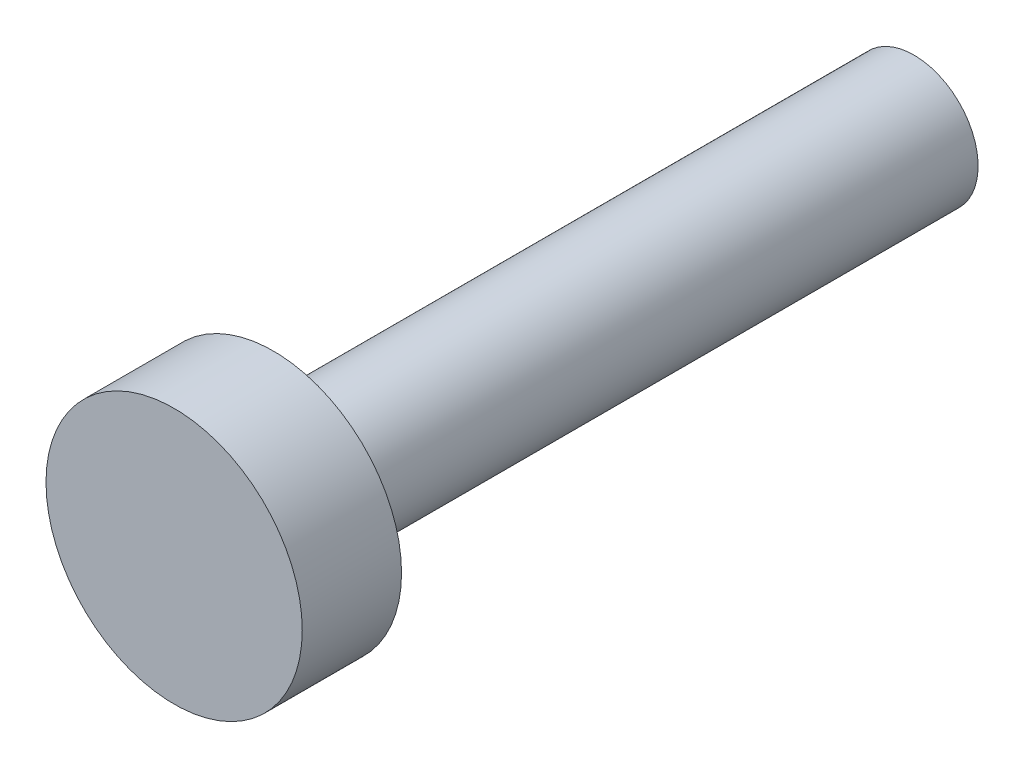
from build123d import *

# Parameters (mm, degrees)
ESQUISSE1_R        = 4
BOSS_EXTRU_1_DEPTH = 3.1
ESQUISSE2_R        = 2
BOSS_EXTRU_2_DEPTH = 20


with BuildPart() as part:
    # Esquisse1 → Boss.-Extru.1 (new body)
    with BuildSketch(Plane.XY):
        with Locations(Location((0, 0, 0), (0, 0, 180))):
            Circle(ESQUISSE1_R)
    extrude(amount=BOSS_EXTRU_1_DEPTH)

    # Esquisse2 → Boss.-Extru.2 (add)
    with BuildSketch(Plane(origin=(0, 0, 0), x_dir=(-1, 0, 0), z_dir=(0, 0, -1))):
        Circle(ESQUISSE2_R)
    extrude(amount=BOSS_EXTRU_2_DEPTH)


solid = part.part
